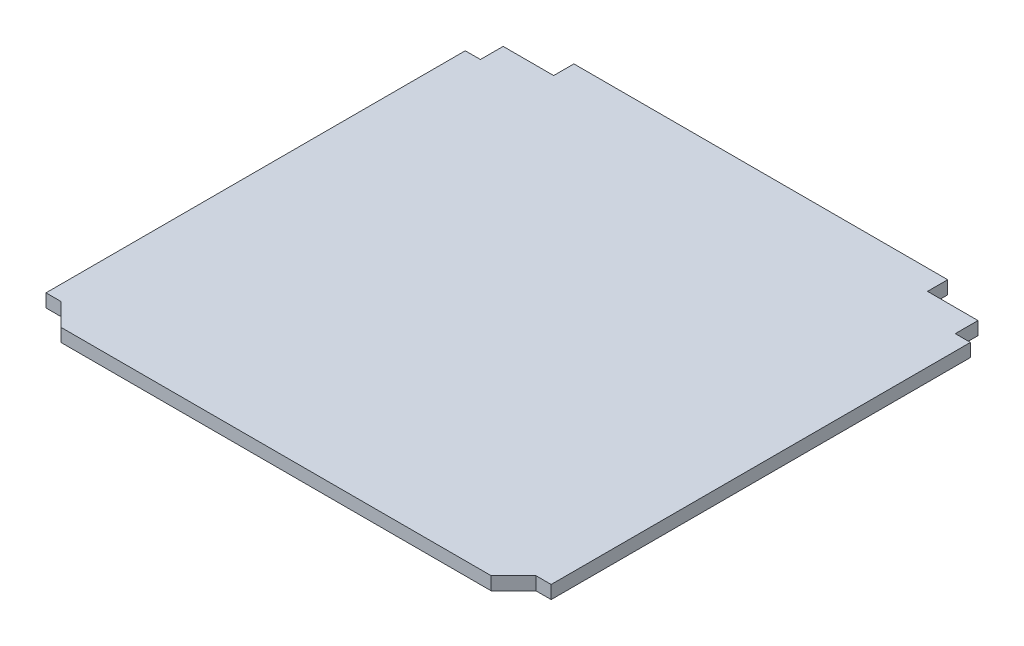
from build123d import *

# Parameters (mm, degrees)
BOSS_EXTRUDE1_DEPTH = 2.6


with BuildPart() as part:
    # Sketch2 → Boss-Extrude1 (new body)
    with BuildSketch(Plane(origin=(0, 0, 0), x_dir=(1, 0, 0), z_dir=(0, 1, 0))):
        Polygon((37, 46), (37, 50), (-37, 50), (-37, 46), (-46, 46), (-47, 46), (-47, 41.5), (-50, 41.5), (-50, -41.5), (-47, -41.5), (-42.568868069, -45.931131931), (42.568868069, -45.931131931), (47, -41.5), (50, -41.5), (50, 41.5), (47, 41.5), (47, 46), (46, 46), align=None)
    extrude(amount=BOSS_EXTRUDE1_DEPTH)


solid = part.part
